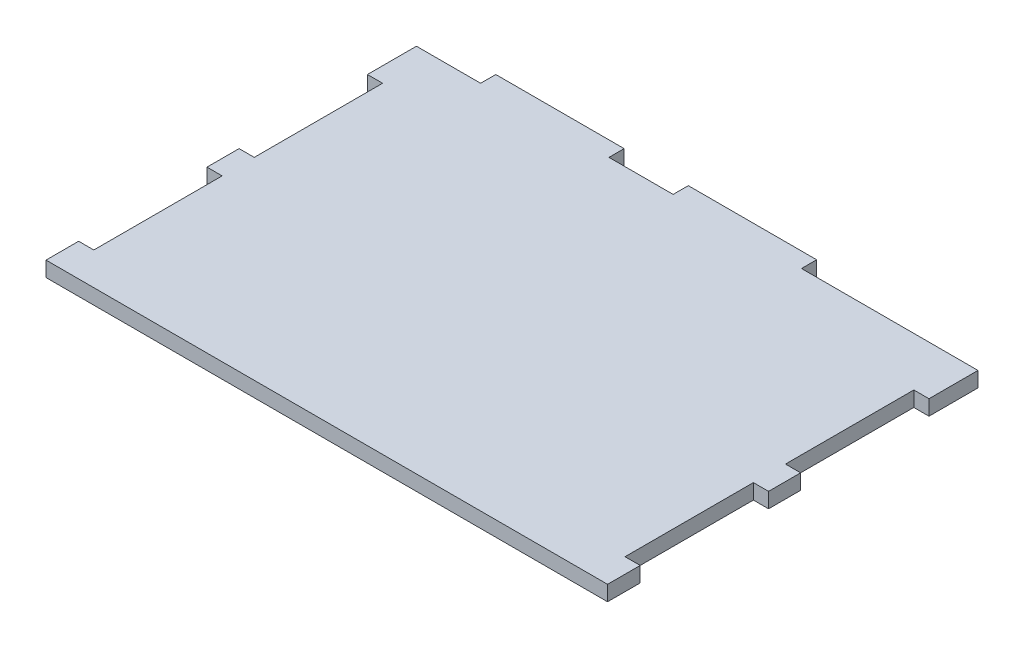
from build123d import *

# Parameters (mm, degrees)
BOSS_EXTRUDE1_DEPTH = 3


with BuildPart() as part:
    # Sketch1 → Boss-Extrude1 (new body)
    with BuildSketch(Plane(origin=(0, 0, 0), x_dir=(1, 0, 0), z_dir=(0, 1, 0))):
        Polygon((20.635, 36.655), (20.635, 39.655), (-4.765, 39.655), (-4.765, 36.655), (-17.465, 36.655), (-17.465, 39.655), (-42.865, 39.655), (-42.865, 36.655), (-55.565, 36.655), (-55.565, 26.955), (-52.565, 26.955), (-52.565, 1.555), (-55.565, 1.555), (-55.565, -4.795), (-52.565, -4.795), (-52.565, -30.195), (-55.565, -30.195), (-55.565, -36.655), (55.565, -36.655), (55.565, -30.195), (52.565, -30.195), (52.565, -4.795), (55.565, -4.795), (55.565, 1.555), (52.565, 1.555), (52.565, 26.955), (55.565, 26.955), (55.565, 36.655), align=None)
    extrude(amount=BOSS_EXTRUDE1_DEPTH)


solid = part.part
